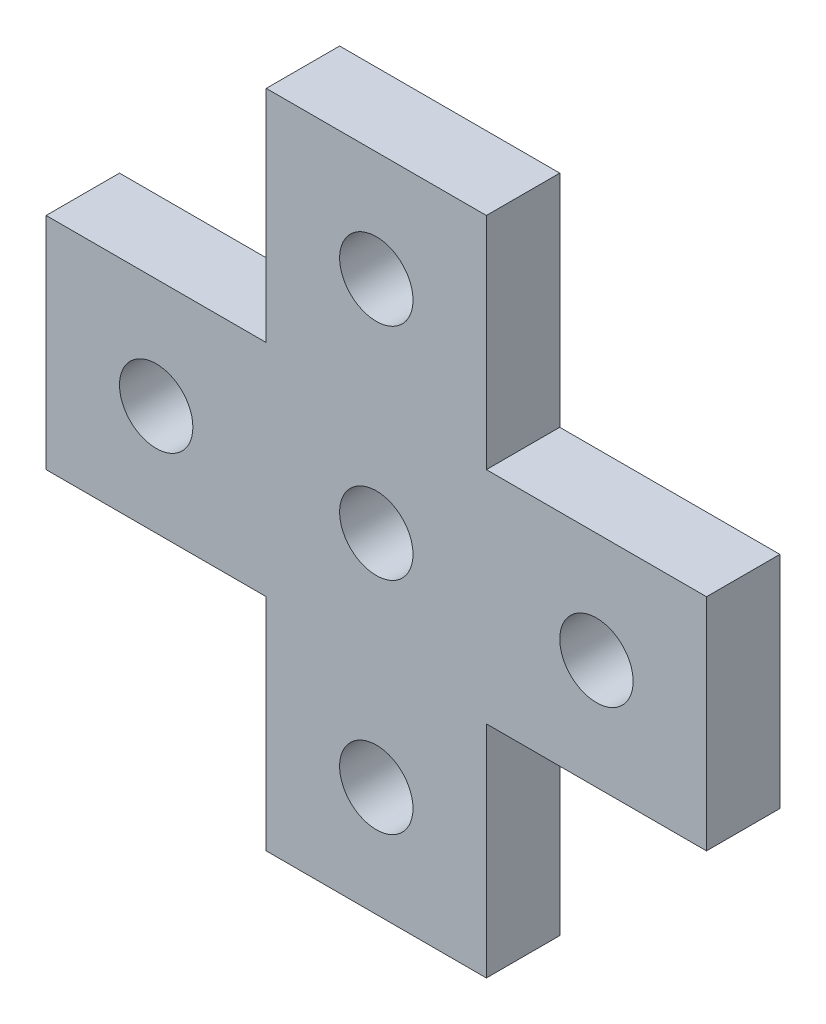
from build123d import *

# Parameters (mm, degrees)
MODEL_R                 = 1.5
SALIENTE_EXTRUIR1_DEPTH = 3


with BuildPart() as part:
    # Model → Saliente-Extruir1 (new body)
    with BuildSketch(Plane.XY):
        Polygon((213.25077615, 165.928489513), (213.25077615, 174.928489513), (204.25077615, 174.928489513), (204.25077615, 165.928489513), (195.25077615, 165.928489513), (195.25077615, 156.928489513), (204.25077615, 156.928489513), (204.25077615, 147.928489513), (213.25077615, 147.928489513), (213.25077615, 156.928489513), (222.25077615, 156.928489513), (222.25077615, 165.928489513), align=None)
        with Locations((208.75077615, 152.428489513)):
            Circle(MODEL_R, mode=Mode.SUBTRACT)
        with Locations((208.75077615, 161.428489513)):
            Circle(MODEL_R, mode=Mode.SUBTRACT)
        with Locations((208.75077615, 170.428489513)):
            Circle(MODEL_R, mode=Mode.SUBTRACT)
        with Locations((199.75077615, 161.428489513)):
            Circle(MODEL_R, mode=Mode.SUBTRACT)
        with Locations((217.75077615, 161.428489513)):
            Circle(MODEL_R, mode=Mode.SUBTRACT)
    extrude(amount=SALIENTE_EXTRUIR1_DEPTH)


solid = part.part
